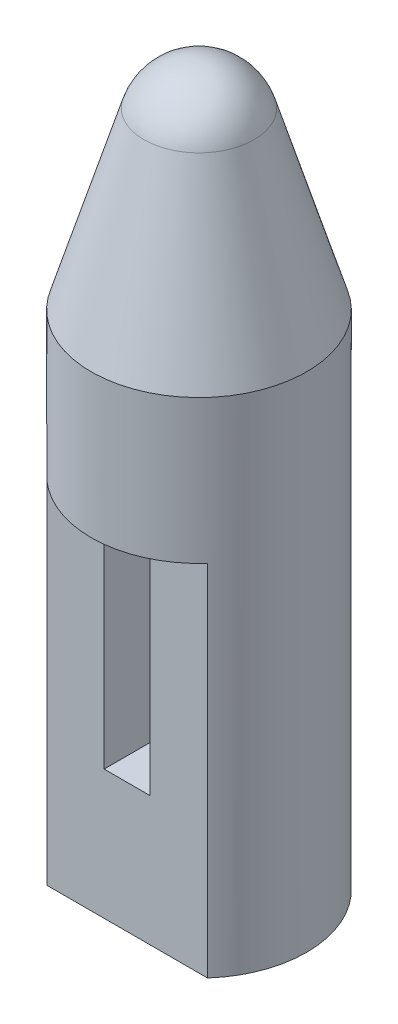
from build123d import *

# Parameters (mm, degrees)
CUT_EXTRUDE_START   = -25
CUT_EXTRUDE_1_DEPTH = 25
SKETCH_3_W          = 3.2
SKETCH_3_H          = 16
CUT_EXTRUDE_2_DEPTH = 4
SKETCH_4_R          = 1.6
CUT_EXTRUDE_3_DEPTH = 10


with BuildPart() as part:
    # 草图1 → 旋转1 (revolve)
    with BuildSketch(Plane.XY, mode=Mode.PRIVATE) as revolve_1_sk:
        with BuildLine():
            Line((-16.340250108, 47.540513379), (-16.340250108, -2.459486621))
            Line((-16.340250108, -2.459486621), (-8.840250108, -2.459486621))
            Line((-8.840250108, -2.459486621), (-8.840250108, 32.540513379))
            Line((-8.840250108, 32.540513379), (-12.511021874, 44.696805356))
            ThreePointArc((-12.511021874, 44.696805356), (-13.955419706, 46.751834595), (-16.340250108, 47.540513379))
        make_face()
    revolve(revolve_1_sk.sketch.rotate(Axis((-16.340250108, 47.540513379, 0), (0, -1, 0)), 180), axis=Axis((-16.340250108, 47.540513379, 0), (0, -1, 0)))

    # 草图2 → 切除-拉伸1 (cut)
    with BuildSketch(Plane.XZ.offset(2.459486621).offset(CUT_EXTRUDE_START)):
        with BuildLine():
            Line((-21.930420052, 5), (-10.750080164, 5))
            ThreePointArc((-10.750080164, 5), (-16.340250108, 7.5), (-21.930420052, 5))
        make_face()
        with BuildLine():
            Line((-21.930420052, -5), (-10.750080164, -5))
            ThreePointArc((-10.750080164, -5), (-16.340250108, -7.5), (-21.930420052, -5))
        make_face()
    extrude(amount=CUT_EXTRUDE_1_DEPTH, mode=Mode.SUBTRACT)

    # 草图3 → 切除-拉伸2 (cut)
    with BuildSketch(Plane.XY.offset(5)):
        with Locations((-16.340250108, 14.540513379)):
            Rectangle(SKETCH_3_W, SKETCH_3_H)
    extrude(amount=-CUT_EXTRUDE_2_DEPTH, mode=Mode.SUBTRACT)

    # 草图4 → 切除-拉伸3 (cut)
    with BuildSketch(Plane.XY.offset(1)):
        with Locations((-16.340250108, 13.540513379)):
            Circle(SKETCH_4_R)
    extrude(amount=-CUT_EXTRUDE_3_DEPTH, mode=Mode.SUBTRACT)


solid = part.part
